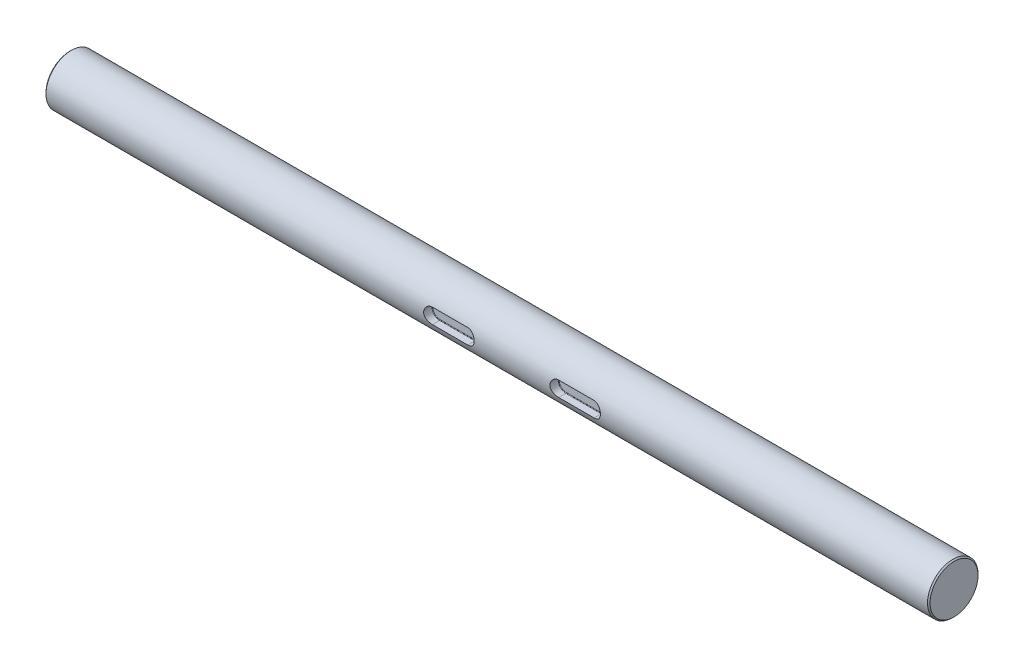
from build123d import *

# Parameters (mm, degrees)
SKETCH1_W           = 350
SKETCH1_H           = 10
CHAMFER1_SIZE       = 0.5
SKETCH2_W           = 20
SKETCH2_H           = 6
BOSS_EXTRUDE1_DEPTH = 3.5
FILLET1_RADIUS      = 3
FILLET1_LENGTH      = 3.5
FILLET2_RADIUS      = 3
FILLET2_LENGTH      = 3.5
FILLET3_R           = 0.2
SKETCH4_W           = 20
SKETCH4_H           = 6
BOSS_EXTRUDE3_DEPTH = 3.5
FILLET4_RADIUS      = 3
FILLET4_LENGTH      = 3.5
FILLET5_RADIUS      = 3
FILLET5_LENGTH      = 3.5
FILLET6_R           = 0.2


with BuildPart() as part:
    # Sketch1 → Revolve1 (revolve)
    with BuildSketch(Plane.XY, mode=Mode.PRIVATE) as revolve1_sk:
        with Locations((175, 5)):
            Rectangle(SKETCH1_W, SKETCH1_H)
    revolve(revolve1_sk.sketch.rotate(Axis((0, 0, 0), (1, 0, 0)), 90), axis=Axis((0, 0, 0), (1, 0, 0)))

    # Chamfer1
    chamfer1_edges = [part.edges().sort_by_distance(p)[0] for p in [
        (0, 0, -10),
        (350, 0, -10),
    ]]
    chamfer(chamfer1_edges, length=CHAMFER1_SIZE)


with BuildPart() as body_2:
    # Sketch2 → Boss-Extrude1 (new body)
    with BuildSketch(Plane.XY.offset(10)):
        with Locations((160, 0)):
            Rectangle(SKETCH2_W, SKETCH2_H)
    extrude(amount=-BOSS_EXTRUDE1_DEPTH)

    # Fillet1: full round fillet: the end face becomes a half cylinder, R = half its width
    fillet1_face = Plane((150, 0, 8.25), x_dir=(0, 0, 1), z_dir=(-1, 0, 0))  # on the end face: x along it, z out of the body
    fillet1_slab = fillet1_face.offset(-FILLET1_RADIUS / 2) * Box(FILLET1_LENGTH, 2 * FILLET1_RADIUS, FILLET1_RADIUS, mode=Mode.PRIVATE)  # the body's end, R deep
    fillet1_round = Plane((153, 0, 8.25), x_dir=(-1, 0, 0), z_dir=(0, 0, 1)) * Cylinder(FILLET1_RADIUS, FILLET1_LENGTH, mode=Mode.PRIVATE)  # its axis R under the face
    add(fillet1_slab - fillet1_round, mode=Mode.SUBTRACT)

    # Fillet2: full round fillet: the end face becomes a half cylinder, R = half its width
    fillet2_face = Plane((170, 0, 8.25), x_dir=(0, 0, 1), z_dir=(1, 0, 0))  # on the end face: x along it, z out of the body
    fillet2_slab = fillet2_face.offset(-FILLET2_RADIUS / 2) * Box(FILLET2_LENGTH, 2 * FILLET2_RADIUS, FILLET2_RADIUS, mode=Mode.PRIVATE)  # the body's end, R deep
    fillet2_round = Plane((167, 0, 8.25), x_dir=(1, 0, 0), z_dir=(0, 0, 1)) * Cylinder(FILLET2_RADIUS, FILLET2_LENGTH, mode=Mode.PRIVATE)  # its axis R under the face
    add(fillet2_slab - fillet2_round, mode=Mode.SUBTRACT)

    # Fillet3
    fillet3_edges = [body_2.edges().sort_by_distance(p)[0] for p in [
        (160, -3, 6.5),
        (150, 0, 6.5),
        (160, 3, 6.5),
        (170, 0, 6.5),
    ]]
    fillet(fillet3_edges, radius=FILLET3_R)


with BuildPart() as part_1:
    add(part.part)

    # Combine1: cut body 2
    add(body_2.part, mode=Mode.SUBTRACT)


with BuildPart() as body_2_2:
    # Sketch4 → Boss-Extrude3 (new body)
    with BuildSketch(Plane.XY.offset(10)):
        with Locations((210, 0)):
            Rectangle(SKETCH4_W, SKETCH4_H)
    extrude(amount=-BOSS_EXTRUDE3_DEPTH)

    # Fillet4: full round fillet: the end face becomes a half cylinder, R = half its width
    fillet4_face = Plane((200, 0, 8.25), x_dir=(0, 0, 1), z_dir=(-1, 0, 0))  # on the end face: x along it, z out of the body
    fillet4_slab = fillet4_face.offset(-FILLET4_RADIUS / 2) * Box(FILLET4_LENGTH, 2 * FILLET4_RADIUS, FILLET4_RADIUS, mode=Mode.PRIVATE)  # the body's end, R deep
    fillet4_round = Plane((203, 0, 8.25), x_dir=(-1, 0, 0), z_dir=(0, 0, 1)) * Cylinder(FILLET4_RADIUS, FILLET4_LENGTH, mode=Mode.PRIVATE)  # its axis R under the face
    add(fillet4_slab - fillet4_round, mode=Mode.SUBTRACT)

    # Fillet5: full round fillet: the end face becomes a half cylinder, R = half its width
    fillet5_face = Plane((220, 0, 8.25), x_dir=(0, 0, -1), z_dir=(1, 0, 0))  # on the end face: x along it, z out of the body
    fillet5_slab = fillet5_face.offset(-FILLET5_RADIUS / 2) * Box(FILLET5_LENGTH, 2 * FILLET5_RADIUS, FILLET5_RADIUS, mode=Mode.PRIVATE)  # the body's end, R deep
    fillet5_round = Plane((217, 0, 8.25), x_dir=(1, 0, 0), z_dir=(0, 0, -1)) * Cylinder(FILLET5_RADIUS, FILLET5_LENGTH, mode=Mode.PRIVATE)  # its axis R under the face
    add(fillet5_slab - fillet5_round, mode=Mode.SUBTRACT)

    # Fillet6
    fillet6_edges = [body_2_2.edges().sort_by_distance(p)[0] for p in [
        (210, -3, 6.5),
        (200, 0, 6.5),
        (210, 3, 6.5),
        (220, 0, 6.5),
    ]]
    fillet(fillet6_edges, radius=FILLET6_R)


with BuildPart() as part_2:
    add(part_1.part)

    # Combine2: cut body 2 2
    add(body_2_2.part, mode=Mode.SUBTRACT)


solid = part_2.part
